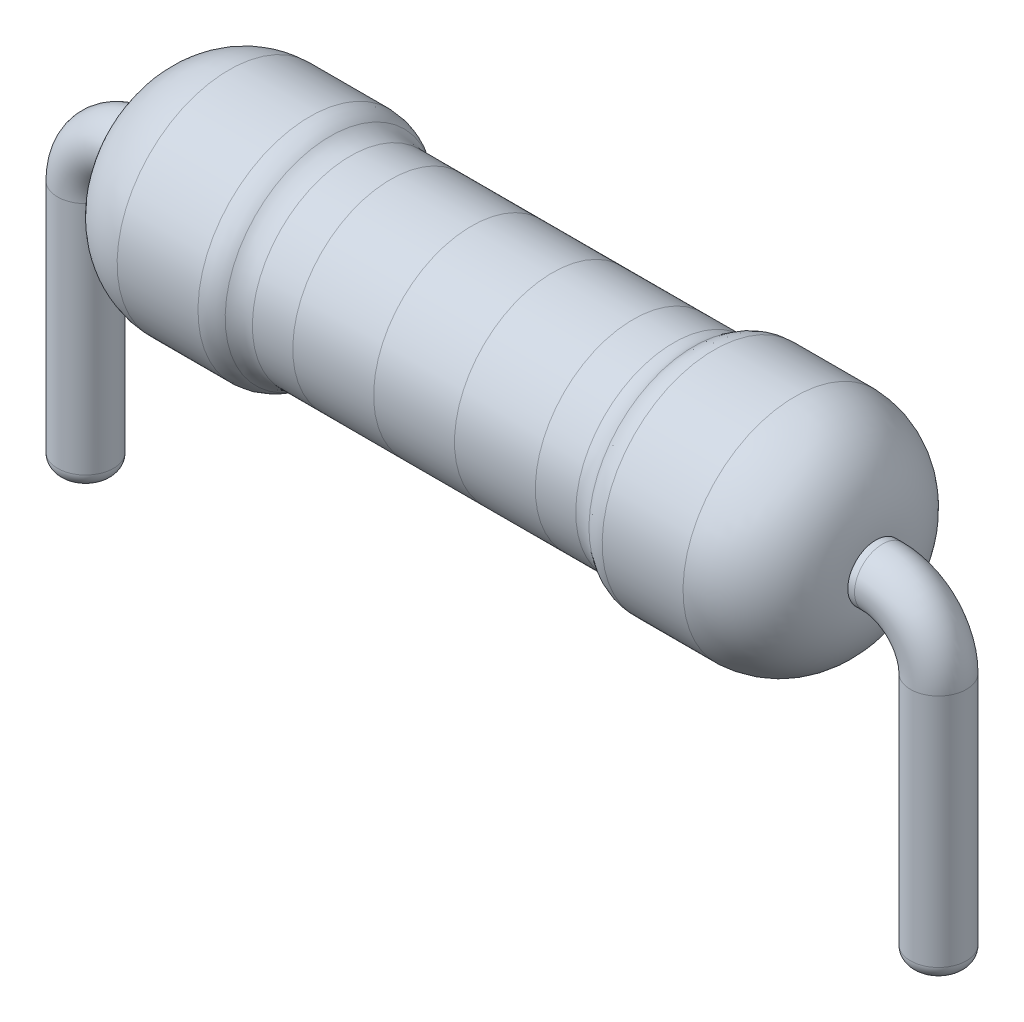
from build123d import *

# Parameters (mm, degrees)
CROQUIS2_R  = 0.25
REDONDEO1_R = 0.125


with BuildPart() as part:
    # Croquis1 → Revolución1 (revolve)
    with BuildSketch(Plane.XY, mode=Mode.PRIVATE) as revoluci_n1_sk:
        with BuildLine():
            Line((-1.444444444, 0.875), (1.444444444, 0.875))
            ThreePointArc((1.444444444, 0.875), (1.539977892, 0.891066953), (1.625, 0.9375))
            ThreePointArc((1.625, 0.9375), (1.710022108, 0.983933047), (1.805555556, 1))
            Line((1.805555556, 1), (2.527777778, 1))
            ThreePointArc((2.527777778, 1), (3.040090759, 0.7706018), (3.25, 0.25))
            Line((3.25, 0.25), (3.25, 0))
            Line((3.25, 0), (-3.25, 0))
            Line((-3.25, 0), (-3.25, 0.25))
            ThreePointArc((-3.25, 0.25), (-3.040090759, 0.7706018), (-2.527777778, 1))
            Line((-2.527777778, 1), (-1.805555556, 1))
            ThreePointArc((-1.805555556, 1), (-1.710022108, 0.983933047), (-1.625, 0.9375))
            ThreePointArc((-1.625, 0.9375), (-1.539977892, 0.891066953), (-1.444444444, 0.875))
        make_face()
    revolve(revoluci_n1_sk.sketch.rotate(Axis((-3.25, 0, 0), (1, 0, 0)), 180), axis=Axis((-3.25, 0, 0), (1, 0, 0)))

    # Barrer1: sweep along a path in Croquis3
    with BuildLine(Plane.XY) as barrer1_path:
        Line((-3.81, -2.725), (-3.81, -0.5))
        ThreePointArc((-3.81, -0.5), (-3.663553391, -0.146446609), (-3.31, 0))
        Line((-3.31, 0), (3.31, 0))
        ThreePointArc((3.31, 0), (3.663553391, -0.146446609), (3.81, -0.5))
        Line((3.81, -0.5), (3.81, -2.725))
    # Croquis2 → Barrer1 (sweep)
    with BuildSketch(Plane(origin=(0, 0, 0), x_dir=(0, 0, -1), z_dir=(1, 0, 0))):
        Circle(CROQUIS2_R)
    sweep(path=barrer1_path.line)

    # Redondeo1
    redondeo1_edges = [part.edges().sort_by_distance(p)[0] for p in [
        (3.81, -2.725, 0.25),
        (-3.81, -2.725, 0.25),
    ]]
    fillet(redondeo1_edges, radius=REDONDEO1_R)


solid = part.part
